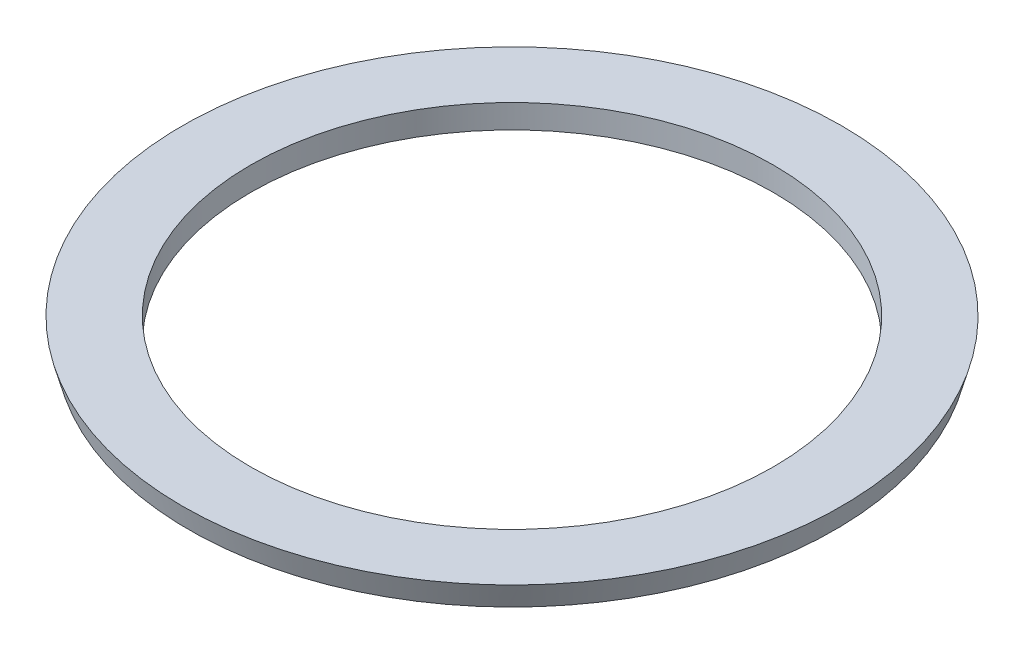
from build123d import *


with BuildPart() as part:
    # Sketch1 → Taper clamp ring (revolve)
    with BuildSketch(Plane.XY, mode=Mode.PRIVATE) as taper_clamp_ring_sk:
        Polygon((22, 33.8), (27.181041647, 33.8), (27.732765785, 35.8), (22, 35.8), align=None)
    revolve(taper_clamp_ring_sk.sketch.rotate(Axis((0, 0, 0), (0, 1, 0)), 90), axis=Axis((0, 0, 0), (0, 1, 0)))


solid = part.part
